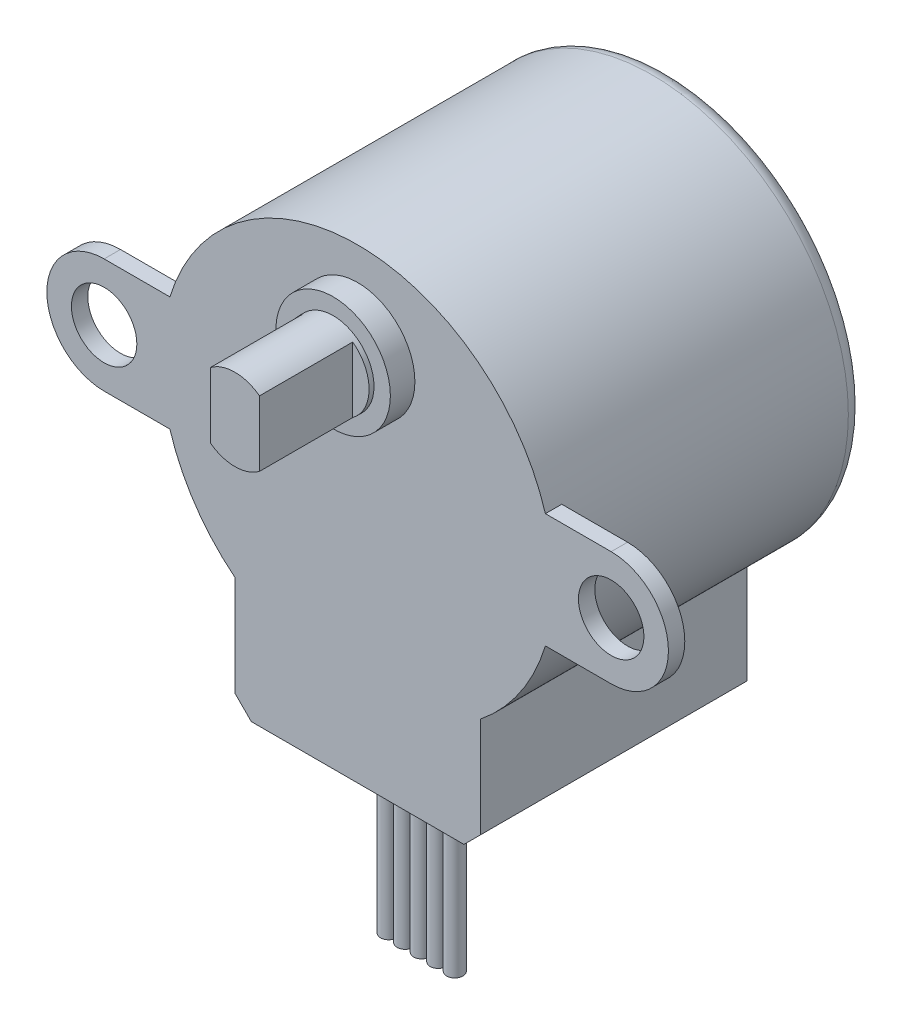
from build123d import *

# Parameters (mm, degrees)
SKETCH_1_R          = 12
EXTRUDE_1_DEPTH     = 19
EXTRUDE_START       = -1
SKETCH_2_R          = 2
EXTRUDE_2_DEPTH     = 1
SKETCH_3_R          = 3.5
EXTRUDE_3_DEPTH     = 1.5
SKETCH_4_R          = 2.5
EXTRUDE_4_DEPTH     = 6
CUT_EXTRUDE_START   = -5.7
CUT_EXTRUDE_1_DEPTH = 5.7
EXTRUDE_START_2     = -16.3
EXTRUDE_5_DEPTH     = 16.3
CHAMFER_1_SIZE      = 1
FILLET_1_R          = 1
CUT_EXTRUDE_2_DEPTH = 2
SKETCH_8_R          = 0.5
EXTRUDE_6_DEPTH     = 13


with BuildPart() as part:
    # Эскиз1 → Бобышка-Вытянуть1 (new body)
    with BuildSketch(Plane.XY):
        Circle(SKETCH_1_R)
    extrude(amount=EXTRUDE_1_DEPTH)

    # Эскиз2 → Бобышка-Вытянуть2 (add)
    # profile 1 of 2: a face of its own
    with BuildSketch(Plane.XY.offset(19).offset(EXTRUDE_START)):
        with BuildLine():
            Line((-15.5, 3.5), (-11.478240283, 3.5))
            ThreePointArc((-11.478240283, 3.5), (-12, 0), (-11.478240283, -3.5))
            Line((-11.478240283, -3.5), (-15.5, -3.5))
            ThreePointArc((-15.5, -3.5), (-19, 0), (-15.5, 3.5))
        make_face()
        with Locations((-15.5, 0)):
            Circle(SKETCH_2_R, mode=Mode.SUBTRACT)
    # profile 2 of 2: a face of its own
    with BuildSketch(Plane.XY.offset(19).offset(EXTRUDE_START)):
        with BuildLine():
            Line((15.5, -3.5), (11.478240283, -3.5))
            ThreePointArc((11.478240283, -3.5), (12, 0), (11.478240283, 3.5))
            Line((11.478240283, 3.5), (15.5, 3.5))
            ThreePointArc((15.5, 3.5), (19, 0), (15.5, -3.5))
        make_face()
        with Locations(Location((15.5, 0, 0), (0, 0, 180))):
            Circle(SKETCH_2_R, mode=Mode.SUBTRACT)
    extrude(amount=EXTRUDE_2_DEPTH)

    # Эскиз3 → Бобышка-Вытянуть3 (add)
    with BuildSketch(Plane.XY.offset(19)):
        with Locations((0, 6.5)):
            Circle(SKETCH_3_R)
    extrude(amount=EXTRUDE_3_DEPTH)

    # Эскиз4 → Бобышка-Вытянуть4 (add)
    with BuildSketch(Plane.XY.offset(20.5)):
        with Locations((0, 6.5)):
            Circle(SKETCH_4_R)
    extrude(amount=EXTRUDE_4_DEPTH)

    # Эскиз5 → Вырез-Вытянуть1 (cut)
    with BuildSketch(Plane.XY.offset(26.5).offset(CUT_EXTRUDE_START)):
        with BuildLine():
            Line((-1.5, 8.5), (-1.5, 4.5))
            ThreePointArc((-1.5, 4.5), (-2.5, 6.5), (-1.5, 8.5))
        make_face()
        with BuildLine():
            Line((1.5, 8.5), (1.5, 4.5))
            ThreePointArc((1.5, 4.5), (2.5, 6.5), (1.5, 8.5))
        make_face()
    extrude(amount=CUT_EXTRUDE_1_DEPTH, mode=Mode.SUBTRACT)

    # Эскиз6 → Бобышка-Вытянуть5 (add)
    with BuildSketch(Plane.XY.offset(19).offset(EXTRUDE_START_2)):
        with BuildLine():
            Line((-7.5, -16.5), (7.5, -16.5))
            Line((7.5, -16.5), (7.5, -9.367496998))
            ThreePointArc((7.5, -9.367496998), (0, -12), (-7.5, -9.367496998))
            Line((-7.5, -9.367496998), (-7.5, -16.5))
        make_face()
    extrude(amount=EXTRUDE_5_DEPTH)

    # Фаска1
    chamfer_1_edges = [part.edges().sort_by_distance(p)[0] for p in [
        (-7.5, -16.5, 10.85),
        (7.5, -16.5, 10.85),
    ]]
    chamfer(chamfer_1_edges, length=CHAMFER_1_SIZE)

    # Скругление1
    fillet_1_edges = [part.edges().sort_by_distance(p)[0] for p in [
        (-12, 0, 0),
    ]]
    fillet(fillet_1_edges, radius=FILLET_1_R)

    # Эскиз7 → Вырез-Вытянуть2 (cut)
    with BuildSketch(Plane.XZ.offset(16.5)):
        with BuildLine():
            Line((-3.5, 15.6), (3.5, 15.6))
            ThreePointArc((3.5, 15.6), (4.1, 15), (3.5, 14.4))
            Line((3.5, 14.4), (-3.5, 14.4))
            ThreePointArc((-3.5, 14.4), (-4.1, 15), (-3.5, 15.6))
        make_face()
    extrude(amount=-CUT_EXTRUDE_2_DEPTH, mode=Mode.SUBTRACT)

    # Эскиз8 → Бобышка-Вытянуть6 (add)
    with BuildSketch(Plane.XZ.offset(14.5)):
        with Locations((-2.1, 15)):
            Circle(SKETCH_8_R)
        with Locations((-1.09, 15)):
            Circle(SKETCH_8_R)
        with Locations((-0.08, 15)):
            Circle(SKETCH_8_R)
        with Locations((0.93, 15)):
            Circle(SKETCH_8_R)
        with Locations((1.94, 15)):
            Circle(SKETCH_8_R)
    extrude(amount=EXTRUDE_6_DEPTH)


solid = part.part
